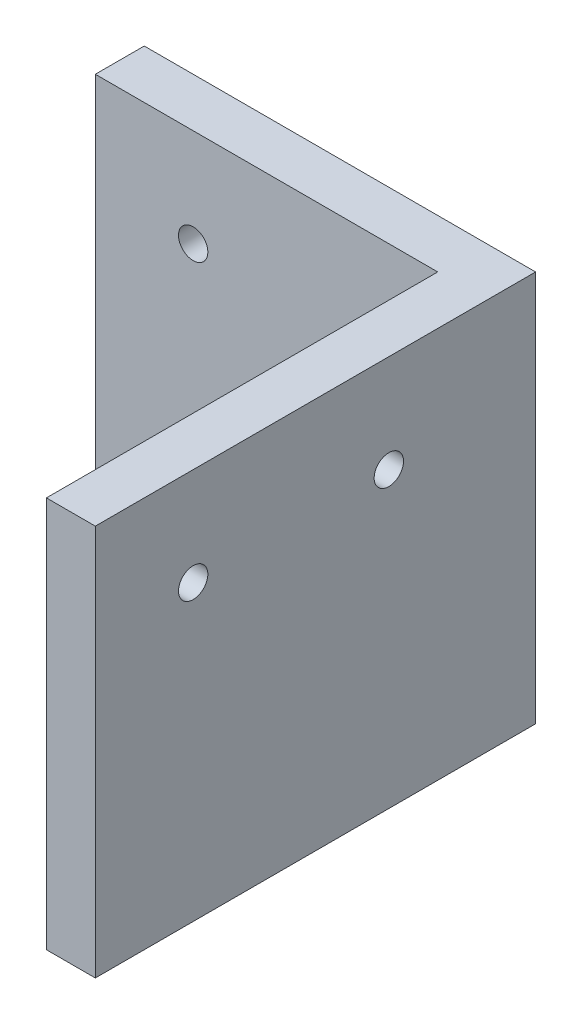
from build123d import *

# Parameters (mm, degrees)
BOSS_EXTRUDE1_DEPTH  = 597.1
SKETCH2_W            = 65.2
SKETCH2_H            = 400
CUT_EXTRUDE1_DEPTH   = 800.095369778
BOSS_EXTRUDE2_DEPTH  = 8
SKETCH4_W            = 525
SKETCH4_H            = 597.1
BOSS_EXTRUDE3_DEPTH  = 7
SKETCH5_W            = 365
SKETCH5_H            = 597.1
CUT_EXTRUDE2_DEPTH   = 10
CUT_EXTRUDE3_REACH   = 802.736
SKETCH6_R            = 2.125
SKETCH7_W            = 20
SKETCH7_H            = 597.1
CUT_EXTRUDE4_DEPTH   = 5
SKETCH8_W            = 55.055493435
SKETCH8_H            = 20
CUT_EXTRUDE6_DEPTH   = 60
BOSS_EXTRUDE4_REACH  = 799.121
SKETCH13_W           = 40
SKETCH13_H           = 15
SKETCH14_W           = 20
SKETCH14_H           = 597.1
CUT_EXTRUDE7_DEPTH   = 5
CUT_EXTRUDE8_REACH   = 802.736
SKETCH15_R           = 1.33
SKETCH16_W           = 35
SKETCH16_H           = 15
CUT_EXTRUDE9_DEPTH   = 60
SKETCH17_W           = 60
SKETCH17_H           = 150
CUT_EXTRUDE10_DEPTH  = 40
SKETCH18_W           = 12
SKETCH18_H           = 16
CUT_EXTRUDE11_DEPTH  = 800.298073312
SKETCH19_W           = 8
SKETCH19_H           = 7
CUT_EXTRUDE12_DEPTH  = 10
CUT_EXTRUDE13_REACH  = 802.736
SKETCH20_R           = 2.75986214
SKETCH20_R_2         = 2.757960919
SKETCH20_R_3         = 2.776094021
SKETCH20_R_4         = 2.751394876
CUT_EXTRUDE14_REACH  = 802.736
SKETCH21_R           = 1.643359813
SKETCH21_R_2         = 1.638913006
SKETCH21_R_3         = 1.644479807
SKETCH21_R_4         = 1.70596398
SKETCH21_R_5         = 1.645380558
SKETCH21_R_6         = 1.646601879
SKETCH21_R_7         = 1.661334202
SKETCH21_R_8         = 1.701244733
CUT_EXTRUDE15_REACH  = 752.719
SKETCH22_W           = 15
SKETCH22_H           = 20
CUT_EXTRUDE16_REACH  = 802.736
SKETCH24_R           = 1.5
SKETCH27_W           = 35
SKETCH27_H           = 15
CUT_EXTRUDE17_DEPTH  = 60
CUT_EXTRUDE18_START  = -60
SKETCH28_W           = 35
SKETCH28_H           = 15
SKETCH28_R           = 1.5
CUT_EXTRUDE18_DEPTH  = 60
SKETCH29_W           = 60
SKETCH29_H           = 150
CUT_EXTRUDE19_DEPTH  = 40
CUT_EXTRUDE20_REACH  = 802.736
SKETCH33_R           = 2.5
SKETCH37_W           = 55
SKETCH37_H           = 20
CUT_EXTRUDE21_DEPTH  = 60
SKETCH39_W           = 5
SKETCH39_H           = 40
BOSS_EXTRUDE6_DEPTH  = 40
SKETCH41_R           = 1.5
CUT_EXTRUDE22_DEPTH  = 799.501603004
SKETCH42_W           = 35
SKETCH42_H           = 15
BOSS_EXTRUDE7_DEPTH  = 60
SKETCH43_W           = 41.147889502
SKETCH43_H           = 41.618954825
SKETCH43_W_2         = 42.4363484
SKETCH43_H_2         = 40
BOSS_EXTRUDE8_DEPTH  = 20
SKETCH44_W           = 49.636924656
SKETCH44_H           = 46.225017069
SKETCH44_W_2         = 46.873520021
BOSS_EXTRUDE9_DEPTH  = 20
SKETCH45_W           = 35
SKETCH45_H           = 15
BOSS_EXTRUDE10_DEPTH = 60
SKETCH46_W           = 5
SKETCH46_H           = 40
BOSS_EXTRUDE11_DEPTH = 40
SKETCH47_R           = 1.5
CUT_EXTRUDE23_DEPTH  = 826.351325194
FILLET1_R            = 5
FILLET2_R            = 5
SKETCH51_W           = 40
SKETCH51_H           = 40
BOSS_EXTRUDE12_DEPTH = 5
SKETCH52_R           = 3
CUT_EXTRUDE26_DEPTH  = 831.93526222
SKETCH53_R           = 3.280439698
BOSS_EXTRUDE13_DEPTH = 570
CUT_EXTRUDE27_START  = -40
SKETCH54_R           = 3.280439698
CUT_EXTRUDE27_DEPTH  = 40
SKETCH55_W           = 485
SKETCH55_H           = 14.478767201
CUT_EXTRUDE28_DEPTH  = 40
SKETCH57_W           = 723.186896727
SKETCH57_H           = 160.707941424
CUT_EXTRUDE30_DEPTH  = 828.51338962
SKETCH58_R           = 4.695658324
SKETCH58_R_2         = 1.5
SKETCH58_R_3         = 4.862906044
BOSS_EXTRUDE14_DEPTH = 5
SKETCH59_R           = 3.5
CUT_EXTRUDE31_DEPTH  = 1.5


with BuildPart() as part:
    # Sketch1 → Boss-Extrude1 (new body)
    with BuildSketch(Plane.XY):
        Polygon((0, 95), (0, 0), (237.916666667, 0), (262.5, 0), (262.5, 15), (80, 15), (80, 80), (70, 80), (70, 75), (50, 75), (50, 80), (40, 80), (40, 75), (20, 75), (20, 95), align=None)
        Polygon((262.5, 15), (262.5, 0), (287.083333333, 0), (525, 0), (525, 95), (505, 95), (505, 75), (485, 75), (485, 80), (475, 80), (475, 75), (455, 75), (455, 80), (445, 80), (445, 15), align=None)
    extrude(amount=BOSS_EXTRUDE1_DEPTH)

    # Sketch2 → Cut-Extrude1 (cut, through all)
    with BuildSketch(Plane(origin=(0, 15, 0), x_dir=(1, 0, 0), z_dir=(0, 1, 0))):
        with Locations((219.9, -200)):
            Rectangle(SKETCH2_W, SKETCH2_H)
        with Locations((305.1, -397.1)):
            Rectangle(SKETCH2_W, SKETCH2_H)
    extrude(amount=-CUT_EXTRUDE1_DEPTH, mode=Mode.SUBTRACT)

    # Sketch3 → Boss-Extrude2 (add)
    with BuildSketch(Plane(origin=(0, 15, 0), x_dir=(1, 0, 0), z_dir=(0, 1, 0))):
        Polygon((252.5, -400), (187.3, -400), (187.3, 0), (80, 0), (80, -597.1), (272.5, -597.1), (272.5, -197.1), (337.7, -197.1), (337.7, -597.1), (445, -597.1), (445, 0), (252.5, 0), align=None)
    extrude(amount=BOSS_EXTRUDE2_DEPTH)

    # Sketch4 → Boss-Extrude3 (add)
    with BuildSketch(Plane.XZ):
        with Locations((262.5, 298.55)):
            Rectangle(SKETCH4_W, SKETCH4_H)
    extrude(amount=BOSS_EXTRUDE3_DEPTH)

    # Sketch5 → Cut-Extrude2 (cut)
    with BuildSketch(Plane(origin=(0, 23, 0), x_dir=(1, 0, 0), z_dir=(0, 1, 0))):
        with Locations((262.5, -298.55)):
            Rectangle(SKETCH5_W, SKETCH5_H)
    extrude(amount=-CUT_EXTRUDE2_DEPTH, mode=Mode.SUBTRACT)

    # Sketch6 → Cut-Extrude3 (cut, up to next)
    with BuildSketch(Plane(origin=(525, 0, 0), x_dir=(0, 0, -1), z_dir=(1, 0, 0)), mode=Mode.PRIVATE) as cut_extrude3_sk1:
        with Locations((-318.55, 79)):
            Circle(SKETCH6_R)
    cut_extrude3_tool1 = extrude(cut_extrude3_sk1.sketch, amount=-CUT_EXTRUDE3_REACH, mode=Mode.PRIVATE) & part.part
    # Sketch6 → Cut-Extrude3 (cut, up to next)
    with BuildSketch(Plane(origin=(525, 0, 0), x_dir=(0, 0, -1), z_dir=(1, 0, 0)), mode=Mode.PRIVATE) as cut_extrude3_sk2:
        with Locations((-318.55, 63)):
            Circle(SKETCH6_R)
    cut_extrude3_tool2 = extrude(cut_extrude3_sk2.sketch, amount=-CUT_EXTRUDE3_REACH, mode=Mode.PRIVATE) & part.part
    # Sketch6 → Cut-Extrude3 (cut, up to next)
    with BuildSketch(Plane(origin=(525, 0, 0), x_dir=(0, 0, -1), z_dir=(1, 0, 0)), mode=Mode.PRIVATE) as cut_extrude3_sk3:
        with Locations((-278.55, 63)):
            Circle(SKETCH6_R)
    cut_extrude3_tool3 = extrude(cut_extrude3_sk3.sketch, amount=-CUT_EXTRUDE3_REACH, mode=Mode.PRIVATE) & part.part
    # Sketch6 → Cut-Extrude3 (cut, up to next)
    with BuildSketch(Plane(origin=(525, 0, 0), x_dir=(0, 0, -1), z_dir=(1, 0, 0)), mode=Mode.PRIVATE) as cut_extrude3_sk4:
        with Locations((-278.55, 79)):
            Circle(SKETCH6_R)
    cut_extrude3_tool4 = extrude(cut_extrude3_sk4.sketch, amount=-CUT_EXTRUDE3_REACH, mode=Mode.PRIVATE) & part.part
    add(cut_extrude3_tool1.solids().sort_by_distance((525, 79, 318.55))[0], mode=Mode.SUBTRACT)
    add(cut_extrude3_tool2.solids().sort_by_distance((525, 63, 318.55))[0], mode=Mode.SUBTRACT)
    add(cut_extrude3_tool3.solids().sort_by_distance((525, 63, 278.55))[0], mode=Mode.SUBTRACT)
    add(cut_extrude3_tool4.solids().sort_by_distance((525, 79, 278.55))[0], mode=Mode.SUBTRACT)

    # Sketch7 → Cut-Extrude4 (cut)
    with BuildSketch(Plane(origin=(0, 75, 0), x_dir=(1, 0, 0), z_dir=(0, 1, 0))):
        with Locations((495, -298.55)):
            Rectangle(SKETCH7_W, SKETCH7_H)
    extrude(amount=-CUT_EXTRUDE4_DEPTH, mode=Mode.SUBTRACT)

    # Sketch8 → Cut-Extrude6 (cut)
    with BuildSketch(Plane.ZY.offset(-445)):
        with Locations((297.395302375, 60)):
            Rectangle(SKETCH8_W, SKETCH8_H)
    extrude(amount=-CUT_EXTRUDE6_DEPTH, mode=Mode.SUBTRACT)

    # Sketch13 → Boss-Extrude4 (add, up to next)
    with BuildSketch(Plane(origin=(0, 50, 0), x_dir=(1, 0, 0), z_dir=(0, 1, 0)), mode=Mode.PRIVATE) as boss_extrude4_sk1:
        with Locations((465, -297.800707188)):
            Rectangle(SKETCH13_W, SKETCH13_H)
    boss_extrude4_tool1 = extrude(boss_extrude4_sk1.sketch, amount=BOSS_EXTRUDE4_REACH, mode=Mode.PRIVATE) - part.part
    add(boss_extrude4_tool1.solids().sort_by_distance((465, 50, 297.800707))[0])

    # Sketch14 → Cut-Extrude7 (cut)
    with BuildSketch(Plane(origin=(0, 75, 0), x_dir=(1, 0, 0), z_dir=(0, 1, 0))):
        with Locations((30, -298.55)):
            Rectangle(SKETCH14_W, SKETCH14_H)
    extrude(amount=-CUT_EXTRUDE7_DEPTH, mode=Mode.SUBTRACT)

    # Sketch15 → Cut-Extrude8 (cut, up to next)
    with BuildSketch(Plane.ZY, mode=Mode.PRIVATE) as cut_extrude8_sk1:
        with Locations((13.5, 82.3)):
            Circle(SKETCH15_R)
    cut_extrude8_tool1 = extrude(cut_extrude8_sk1.sketch, amount=-CUT_EXTRUDE8_REACH, mode=Mode.PRIVATE) & part.part
    # Sketch15 → Cut-Extrude8 (cut, up to next)
    with BuildSketch(Plane.ZY, mode=Mode.PRIVATE) as cut_extrude8_sk2:
        with Locations((33.5, 82.3)):
            Circle(SKETCH15_R)
    cut_extrude8_tool2 = extrude(cut_extrude8_sk2.sketch, amount=-CUT_EXTRUDE8_REACH, mode=Mode.PRIVATE) & part.part
    # Sketch15 → Cut-Extrude8 (cut, up to next)
    with BuildSketch(Plane.ZY, mode=Mode.PRIVATE) as cut_extrude8_sk3:
        with Locations((13.5, 62.3)):
            Circle(SKETCH15_R)
    cut_extrude8_tool3 = extrude(cut_extrude8_sk3.sketch, amount=-CUT_EXTRUDE8_REACH, mode=Mode.PRIVATE) & part.part
    # Sketch15 → Cut-Extrude8 (cut, up to next)
    with BuildSketch(Plane.ZY, mode=Mode.PRIVATE) as cut_extrude8_sk4:
        with Locations((33.5, 62.3)):
            Circle(SKETCH15_R)
    cut_extrude8_tool4 = extrude(cut_extrude8_sk4.sketch, amount=-CUT_EXTRUDE8_REACH, mode=Mode.PRIVATE) & part.part
    # Sketch15 → Cut-Extrude8 (cut, up to next)
    with BuildSketch(Plane.ZY, mode=Mode.PRIVATE) as cut_extrude8_sk5:
        with Locations((563.6, 82.3)):
            Circle(SKETCH15_R)
    cut_extrude8_tool5 = extrude(cut_extrude8_sk5.sketch, amount=-CUT_EXTRUDE8_REACH, mode=Mode.PRIVATE) & part.part
    # Sketch15 → Cut-Extrude8 (cut, up to next)
    with BuildSketch(Plane.ZY, mode=Mode.PRIVATE) as cut_extrude8_sk6:
        with Locations((583.6, 62.3)):
            Circle(SKETCH15_R)
    cut_extrude8_tool6 = extrude(cut_extrude8_sk6.sketch, amount=-CUT_EXTRUDE8_REACH, mode=Mode.PRIVATE) & part.part
    # Sketch15 → Cut-Extrude8 (cut, up to next)
    with BuildSketch(Plane.ZY, mode=Mode.PRIVATE) as cut_extrude8_sk7:
        with Locations((563.6, 62.3)):
            Circle(SKETCH15_R)
    cut_extrude8_tool7 = extrude(cut_extrude8_sk7.sketch, amount=-CUT_EXTRUDE8_REACH, mode=Mode.PRIVATE) & part.part
    # Sketch15 → Cut-Extrude8 (cut, up to next)
    with BuildSketch(Plane.ZY, mode=Mode.PRIVATE) as cut_extrude8_sk8:
        with Locations(Location((583.6, 82.3, 0), (0, 0, 90))):
            Circle(SKETCH15_R)
    cut_extrude8_tool8 = extrude(cut_extrude8_sk8.sketch, amount=-CUT_EXTRUDE8_REACH, mode=Mode.PRIVATE) & part.part
    add(cut_extrude8_tool1.solids().sort_by_distance((0, 82.3, 13.5))[0], mode=Mode.SUBTRACT)
    add(cut_extrude8_tool2.solids().sort_by_distance((0, 82.3, 33.5))[0], mode=Mode.SUBTRACT)
    add(cut_extrude8_tool3.solids().sort_by_distance((0, 62.3, 13.5))[0], mode=Mode.SUBTRACT)
    add(cut_extrude8_tool4.solids().sort_by_distance((0, 62.3, 33.5))[0], mode=Mode.SUBTRACT)
    add(cut_extrude8_tool5.solids().sort_by_distance((0, 82.3, 563.6))[0], mode=Mode.SUBTRACT)
    add(cut_extrude8_tool6.solids().sort_by_distance((0, 62.3, 583.6))[0], mode=Mode.SUBTRACT)
    add(cut_extrude8_tool7.solids().sort_by_distance((0, 62.3, 563.6))[0], mode=Mode.SUBTRACT)
    add(cut_extrude8_tool8.solids().sort_by_distance((0, 82.3, 583.6))[0], mode=Mode.SUBTRACT)

    # Sketch16 → Cut-Extrude9 (cut)
    with BuildSketch(Plane(origin=(80, 0, 0), x_dir=(0, 0, -1), z_dir=(1, 0, 0))):
        with Locations((-574.6, 62.5)):
            Rectangle(SKETCH16_W, SKETCH16_H)
        with Locations((-22.5, 62.5)):
            Rectangle(SKETCH16_W, SKETCH16_H)
    extrude(amount=-CUT_EXTRUDE9_DEPTH, mode=Mode.SUBTRACT)

    # Sketch17 → Cut-Extrude10 (cut)
    with BuildSketch(Plane.XZ.offset(7)):
        with Locations((495, 298.55)):
            Rectangle(SKETCH17_W, SKETCH17_H)
    extrude(amount=-CUT_EXTRUDE10_DEPTH, mode=Mode.SUBTRACT)

    # Sketch18 → Cut-Extrude11 (cut, through all)
    with BuildSketch(Plane(origin=(0, 13, 0), x_dir=(1, 0, 0), z_dir=(0, 1, 0))):
        with Locations((421, -294.05)):
            Rectangle(SKETCH18_W, SKETCH18_H)
    extrude(amount=-CUT_EXTRUDE11_DEPTH, mode=Mode.SUBTRACT)

    # Sketch19 → Cut-Extrude12 (cut)
    with BuildSketch(Plane(origin=(0, 13, 0), x_dir=(1, 0, 0), z_dir=(0, 1, 0))):
        with Locations((421, -282.55)):
            Rectangle(SKETCH19_W, SKETCH19_H)
        with Locations((421, -305.55)):
            Rectangle(SKETCH19_W, SKETCH19_H)
    extrude(amount=-CUT_EXTRUDE12_DEPTH, mode=Mode.SUBTRACT)

    # Sketch20 → Cut-Extrude13 (cut, up to next)
    with BuildSketch(Plane(origin=(525, 0, 0), x_dir=(0, 0, -1), z_dir=(1, 0, 0)), mode=Mode.PRIVATE) as cut_extrude13_sk1:
        with Locations((-318.55, 79)):
            Circle(SKETCH20_R)
    cut_extrude13_tool1 = extrude(cut_extrude13_sk1.sketch, amount=-CUT_EXTRUDE13_REACH, mode=Mode.PRIVATE) & part.part
    # Sketch20 → Cut-Extrude13 (cut, up to next)
    with BuildSketch(Plane(origin=(525, 0, 0), x_dir=(0, 0, -1), z_dir=(1, 0, 0)), mode=Mode.PRIVATE) as cut_extrude13_sk2:
        with Locations((-318.55, 63)):
            Circle(SKETCH20_R_2)
    cut_extrude13_tool2 = extrude(cut_extrude13_sk2.sketch, amount=-CUT_EXTRUDE13_REACH, mode=Mode.PRIVATE) & part.part
    # Sketch20 → Cut-Extrude13 (cut, up to next)
    with BuildSketch(Plane(origin=(525, 0, 0), x_dir=(0, 0, -1), z_dir=(1, 0, 0)), mode=Mode.PRIVATE) as cut_extrude13_sk3:
        with Locations((-278.55, 63)):
            Circle(SKETCH20_R_3)
    cut_extrude13_tool3 = extrude(cut_extrude13_sk3.sketch, amount=-CUT_EXTRUDE13_REACH, mode=Mode.PRIVATE) & part.part
    # Sketch20 → Cut-Extrude13 (cut, up to next)
    with BuildSketch(Plane(origin=(525, 0, 0), x_dir=(0, 0, -1), z_dir=(1, 0, 0)), mode=Mode.PRIVATE) as cut_extrude13_sk4:
        with Locations((-278.55, 79)):
            Circle(SKETCH20_R_4)
    cut_extrude13_tool4 = extrude(cut_extrude13_sk4.sketch, amount=-CUT_EXTRUDE13_REACH, mode=Mode.PRIVATE) & part.part
    add(cut_extrude13_tool1.solids().sort_by_distance((525, 79, 318.55))[0], mode=Mode.SUBTRACT)
    add(cut_extrude13_tool2.solids().sort_by_distance((525, 63, 318.55))[0], mode=Mode.SUBTRACT)
    add(cut_extrude13_tool3.solids().sort_by_distance((525, 63, 278.55))[0], mode=Mode.SUBTRACT)
    add(cut_extrude13_tool4.solids().sort_by_distance((525, 79, 278.55))[0], mode=Mode.SUBTRACT)

    # Sketch21 → Cut-Extrude14 (cut, up to next)
    with BuildSketch(Plane.ZY, mode=Mode.PRIVATE) as cut_extrude14_sk1:
        with Locations((13.5, 82.3)):
            Circle(SKETCH21_R)
    cut_extrude14_tool1 = extrude(cut_extrude14_sk1.sketch, amount=-CUT_EXTRUDE14_REACH, mode=Mode.PRIVATE) & part.part
    # Sketch21 → Cut-Extrude14 (cut, up to next)
    with BuildSketch(Plane.ZY, mode=Mode.PRIVATE) as cut_extrude14_sk2:
        with Locations((13.5, 62.3)):
            Circle(SKETCH21_R_2)
    cut_extrude14_tool2 = extrude(cut_extrude14_sk2.sketch, amount=-CUT_EXTRUDE14_REACH, mode=Mode.PRIVATE) & part.part
    # Sketch21 → Cut-Extrude14 (cut, up to next)
    with BuildSketch(Plane.ZY, mode=Mode.PRIVATE) as cut_extrude14_sk3:
        with Locations((33.5, 62.3)):
            Circle(SKETCH21_R_3)
    cut_extrude14_tool3 = extrude(cut_extrude14_sk3.sketch, amount=-CUT_EXTRUDE14_REACH, mode=Mode.PRIVATE) & part.part
    # Sketch21 → Cut-Extrude14 (cut, up to next)
    with BuildSketch(Plane.ZY, mode=Mode.PRIVATE) as cut_extrude14_sk4:
        with Locations((33.5, 82.3)):
            Circle(SKETCH21_R_4)
    cut_extrude14_tool4 = extrude(cut_extrude14_sk4.sketch, amount=-CUT_EXTRUDE14_REACH, mode=Mode.PRIVATE) & part.part
    # Sketch21 → Cut-Extrude14 (cut, up to next)
    with BuildSketch(Plane.ZY, mode=Mode.PRIVATE) as cut_extrude14_sk5:
        with Locations((563.6, 62.3)):
            Circle(SKETCH21_R_5)
    cut_extrude14_tool5 = extrude(cut_extrude14_sk5.sketch, amount=-CUT_EXTRUDE14_REACH, mode=Mode.PRIVATE) & part.part
    # Sketch21 → Cut-Extrude14 (cut, up to next)
    with BuildSketch(Plane.ZY, mode=Mode.PRIVATE) as cut_extrude14_sk6:
        with Locations((583.6, 62.3)):
            Circle(SKETCH21_R_6)
    cut_extrude14_tool6 = extrude(cut_extrude14_sk6.sketch, amount=-CUT_EXTRUDE14_REACH, mode=Mode.PRIVATE) & part.part
    # Sketch21 → Cut-Extrude14 (cut, up to next)
    with BuildSketch(Plane.ZY, mode=Mode.PRIVATE) as cut_extrude14_sk7:
        with Locations((583.6, 82.3)):
            Circle(SKETCH21_R_7)
    cut_extrude14_tool7 = extrude(cut_extrude14_sk7.sketch, amount=-CUT_EXTRUDE14_REACH, mode=Mode.PRIVATE) & part.part
    # Sketch21 → Cut-Extrude14 (cut, up to next)
    with BuildSketch(Plane.ZY, mode=Mode.PRIVATE) as cut_extrude14_sk8:
        with Locations((563.6, 82.3)):
            Circle(SKETCH21_R_8)
    cut_extrude14_tool8 = extrude(cut_extrude14_sk8.sketch, amount=-CUT_EXTRUDE14_REACH, mode=Mode.PRIVATE) & part.part
    add(cut_extrude14_tool1.solids().sort_by_distance((0, 82.3, 13.5))[0], mode=Mode.SUBTRACT)
    add(cut_extrude14_tool2.solids().sort_by_distance((0, 62.3, 13.5))[0], mode=Mode.SUBTRACT)
    add(cut_extrude14_tool3.solids().sort_by_distance((0, 62.3, 33.5))[0], mode=Mode.SUBTRACT)
    add(cut_extrude14_tool4.solids().sort_by_distance((0, 82.3, 33.5))[0], mode=Mode.SUBTRACT)
    add(cut_extrude14_tool5.solids().sort_by_distance((0, 62.3, 563.6))[0], mode=Mode.SUBTRACT)
    add(cut_extrude14_tool6.solids().sort_by_distance((0, 62.3, 583.6))[0], mode=Mode.SUBTRACT)
    add(cut_extrude14_tool7.solids().sort_by_distance((0, 82.3, 583.6))[0], mode=Mode.SUBTRACT)
    add(cut_extrude14_tool8.solids().sort_by_distance((0, 82.3, 563.6))[0], mode=Mode.SUBTRACT)

    # Sketch22 → Cut-Extrude15 (cut, up to next)
    with BuildSketch(Plane.ZY.offset(-445), mode=Mode.PRIVATE) as cut_extrude15_sk1:
        with Locations((297.800707188, 60)):
            Rectangle(SKETCH22_W, SKETCH22_H)
    cut_extrude15_tool1 = extrude(cut_extrude15_sk1.sketch, amount=-CUT_EXTRUDE15_REACH, mode=Mode.PRIVATE) & part.part
    add(cut_extrude15_tool1.solids().sort_by_distance((445, 60, 297.800707))[0], mode=Mode.SUBTRACT)

    # Sketch24 → Cut-Extrude16 (cut, up to next)
    with BuildSketch(Plane(origin=(525, 0, 0), x_dir=(0, 0, -1), z_dir=(1, 0, 0)), mode=Mode.PRIVATE) as cut_extrude16_sk1:
        with Locations((-583.6, 82.3)):
            Circle(SKETCH24_R)
    cut_extrude16_tool1 = extrude(cut_extrude16_sk1.sketch, amount=-CUT_EXTRUDE16_REACH, mode=Mode.PRIVATE) & part.part
    # Sketch24 → Cut-Extrude16 (cut, up to next)
    with BuildSketch(Plane(origin=(525, 0, 0), x_dir=(0, 0, -1), z_dir=(1, 0, 0)), mode=Mode.PRIVATE) as cut_extrude16_sk2:
        with Locations((-563.6, 82.3)):
            Circle(SKETCH24_R)
    cut_extrude16_tool2 = extrude(cut_extrude16_sk2.sketch, amount=-CUT_EXTRUDE16_REACH, mode=Mode.PRIVATE) & part.part
    # Sketch24 → Cut-Extrude16 (cut, up to next)
    with BuildSketch(Plane(origin=(525, 0, 0), x_dir=(0, 0, -1), z_dir=(1, 0, 0)), mode=Mode.PRIVATE) as cut_extrude16_sk3:
        with Locations((-583.6, 62.3)):
            Circle(SKETCH24_R)
    cut_extrude16_tool3 = extrude(cut_extrude16_sk3.sketch, amount=-CUT_EXTRUDE16_REACH, mode=Mode.PRIVATE) & part.part
    # Sketch24 → Cut-Extrude16 (cut, up to next)
    with BuildSketch(Plane(origin=(525, 0, 0), x_dir=(0, 0, -1), z_dir=(1, 0, 0)), mode=Mode.PRIVATE) as cut_extrude16_sk4:
        with Locations((-563.6, 62.3)):
            Circle(SKETCH24_R)
    cut_extrude16_tool4 = extrude(cut_extrude16_sk4.sketch, amount=-CUT_EXTRUDE16_REACH, mode=Mode.PRIVATE) & part.part
    # Sketch24 → Cut-Extrude16 (cut, up to next)
    with BuildSketch(Plane(origin=(525, 0, 0), x_dir=(0, 0, -1), z_dir=(1, 0, 0)), mode=Mode.PRIVATE) as cut_extrude16_sk5:
        with Locations((-33.5, 82.3)):
            Circle(SKETCH24_R)
    cut_extrude16_tool5 = extrude(cut_extrude16_sk5.sketch, amount=-CUT_EXTRUDE16_REACH, mode=Mode.PRIVATE) & part.part
    # Sketch24 → Cut-Extrude16 (cut, up to next)
    with BuildSketch(Plane(origin=(525, 0, 0), x_dir=(0, 0, -1), z_dir=(1, 0, 0)), mode=Mode.PRIVATE) as cut_extrude16_sk6:
        with Locations((-13.5, 82.3)):
            Circle(SKETCH24_R)
    cut_extrude16_tool6 = extrude(cut_extrude16_sk6.sketch, amount=-CUT_EXTRUDE16_REACH, mode=Mode.PRIVATE) & part.part
    # Sketch24 → Cut-Extrude16 (cut, up to next)
    with BuildSketch(Plane(origin=(525, 0, 0), x_dir=(0, 0, -1), z_dir=(1, 0, 0)), mode=Mode.PRIVATE) as cut_extrude16_sk7:
        with Locations((-13.5, 62.3)):
            Circle(SKETCH24_R)
    cut_extrude16_tool7 = extrude(cut_extrude16_sk7.sketch, amount=-CUT_EXTRUDE16_REACH, mode=Mode.PRIVATE) & part.part
    # Sketch24 → Cut-Extrude16 (cut, up to next)
    with BuildSketch(Plane(origin=(525, 0, 0), x_dir=(0, 0, -1), z_dir=(1, 0, 0)), mode=Mode.PRIVATE) as cut_extrude16_sk8:
        with Locations((-33.5, 62.3)):
            Circle(SKETCH24_R)
    cut_extrude16_tool8 = extrude(cut_extrude16_sk8.sketch, amount=-CUT_EXTRUDE16_REACH, mode=Mode.PRIVATE) & part.part
    add(cut_extrude16_tool1.solids().sort_by_distance((525, 82.3, 583.6))[0], mode=Mode.SUBTRACT)
    add(cut_extrude16_tool2.solids().sort_by_distance((525, 82.3, 563.6))[0], mode=Mode.SUBTRACT)
    add(cut_extrude16_tool3.solids().sort_by_distance((525, 62.3, 583.6))[0], mode=Mode.SUBTRACT)
    add(cut_extrude16_tool4.solids().sort_by_distance((525, 62.3, 563.6))[0], mode=Mode.SUBTRACT)
    add(cut_extrude16_tool5.solids().sort_by_distance((525, 82.3, 33.5))[0], mode=Mode.SUBTRACT)
    add(cut_extrude16_tool6.solids().sort_by_distance((525, 82.3, 13.5))[0], mode=Mode.SUBTRACT)
    add(cut_extrude16_tool7.solids().sort_by_distance((525, 62.3, 13.5))[0], mode=Mode.SUBTRACT)
    add(cut_extrude16_tool8.solids().sort_by_distance((525, 62.3, 33.5))[0], mode=Mode.SUBTRACT)

    # Sketch27 → Cut-Extrude17 (cut)
    with BuildSketch(Plane.ZY.offset(-445)):
        with Locations((574.6, 62.5)):
            Rectangle(SKETCH27_W, SKETCH27_H)
    extrude(amount=-CUT_EXTRUDE17_DEPTH, mode=Mode.SUBTRACT)

    # Sketch28 → Cut-Extrude18 (cut)
    with BuildSketch(Plane.ZY.offset(-445).offset(CUT_EXTRUDE18_START)):
        with Locations((22.5, 62.5)):
            Rectangle(SKETCH28_W, SKETCH28_H)
        with Locations(Location((13.5, 62.3, 0), (0, 0, 180))):
            Circle(SKETCH28_R, mode=Mode.SUBTRACT)
        with Locations(Location((33.5, 62.3, 0), (0, 0, 180))):
            Circle(SKETCH28_R, mode=Mode.SUBTRACT)
    extrude(amount=CUT_EXTRUDE18_DEPTH, mode=Mode.SUBTRACT)

    # Sketch29 → Cut-Extrude19 (cut)
    with BuildSketch(Plane.XZ.offset(7)):
        with Locations((30, 298.55)):
            Rectangle(SKETCH29_W, SKETCH29_H)
    extrude(amount=-CUT_EXTRUDE19_DEPTH, mode=Mode.SUBTRACT)

    # Sketch33 → Cut-Extrude20 (cut, up to next)
    with BuildSketch(Plane.ZY, mode=Mode.PRIVATE) as cut_extrude20_sk1:
        with Locations((318.55, 79)):
            Circle(SKETCH33_R)
    cut_extrude20_tool1 = extrude(cut_extrude20_sk1.sketch, amount=-CUT_EXTRUDE20_REACH, mode=Mode.PRIVATE) & part.part
    # Sketch33 → Cut-Extrude20 (cut, up to next)
    with BuildSketch(Plane.ZY, mode=Mode.PRIVATE) as cut_extrude20_sk2:
        with Locations((319.356498111, 63)):
            Circle(SKETCH33_R)
    cut_extrude20_tool2 = extrude(cut_extrude20_sk2.sketch, amount=-CUT_EXTRUDE20_REACH, mode=Mode.PRIVATE) & part.part
    # Sketch33 → Cut-Extrude20 (cut, up to next)
    with BuildSketch(Plane.ZY, mode=Mode.PRIVATE) as cut_extrude20_sk3:
        with Locations((278.55, 79)):
            Circle(SKETCH33_R)
    cut_extrude20_tool3 = extrude(cut_extrude20_sk3.sketch, amount=-CUT_EXTRUDE20_REACH, mode=Mode.PRIVATE) & part.part
    # Sketch33 → Cut-Extrude20 (cut, up to next)
    with BuildSketch(Plane.ZY, mode=Mode.PRIVATE) as cut_extrude20_sk4:
        with Locations((279.356498111, 63)):
            Circle(SKETCH33_R)
    cut_extrude20_tool4 = extrude(cut_extrude20_sk4.sketch, amount=-CUT_EXTRUDE20_REACH, mode=Mode.PRIVATE) & part.part
    add(cut_extrude20_tool1.solids().sort_by_distance((0, 79, 318.55))[0], mode=Mode.SUBTRACT)
    add(cut_extrude20_tool2.solids().sort_by_distance((0, 63, 319.356498))[0], mode=Mode.SUBTRACT)
    add(cut_extrude20_tool3.solids().sort_by_distance((0, 79, 278.55))[0], mode=Mode.SUBTRACT)
    add(cut_extrude20_tool4.solids().sort_by_distance((0, 63, 279.356498))[0], mode=Mode.SUBTRACT)

    # Sketch37 → Cut-Extrude21 (cut)
    with BuildSketch(Plane(origin=(80, 0, 0), x_dir=(0, 0, -1), z_dir=(1, 0, 0))):
        with Locations((-299.68, 60)):
            Rectangle(SKETCH37_W, SKETCH37_H)
    extrude(amount=-CUT_EXTRUDE21_DEPTH, mode=Mode.SUBTRACT)

    # Sketch39 → Boss-Extrude6 (add)
    with BuildSketch(Plane.ZY):
        with Locations((5.5, 75)):
            Rectangle(SKETCH39_W, SKETCH39_H)
        with Locations((591.6, 75)):
            Rectangle(SKETCH39_W, SKETCH39_H)
    extrude(amount=BOSS_EXTRUDE6_DEPTH)

    # Sketch41 → Cut-Extrude22 (cut, through all)
    with BuildSketch(Plane(origin=(0, 0, 3), x_dir=(-1, 0, 0), z_dir=(0, 0, -1))):
        with Locations((10, 85)):
            Circle(SKETCH41_R)
        with Locations((30, 85)):
            Circle(SKETCH41_R)
        with Locations((30, 65)):
            Circle(SKETCH41_R)
        with Locations((10, 65)):
            Circle(SKETCH41_R)
    extrude(amount=-CUT_EXTRUDE22_DEPTH, mode=Mode.SUBTRACT)

    # Sketch42 → Boss-Extrude7 (add)
    with BuildSketch(Plane(origin=(80, 0, 0), x_dir=(0, 0, -1), z_dir=(1, 0, 0))):
        with Locations((-574.6, 62.5)):
            Rectangle(SKETCH42_W, SKETCH42_H)
        with Locations((-22.5, 62.5)):
            Rectangle(SKETCH42_W, SKETCH42_H)
    extrude(amount=-BOSS_EXTRUDE7_DEPTH)

    # Sketch43 → Boss-Extrude8 (add)
    with BuildSketch(Plane.ZY):
        with Locations((28.573944751, 74.190522587)):
            Rectangle(SKETCH43_W, SKETCH43_H)
        with Locations((567.8818258, 75)):
            Rectangle(SKETCH43_W_2, SKETCH43_H_2)
    extrude(amount=-BOSS_EXTRUDE8_DEPTH)

    # Sketch44 → Boss-Extrude9 (add)
    with BuildSketch(Plane(origin=(525, 0, 0), x_dir=(0, 0, -1), z_dir=(1, 0, 0))):
        with Locations((-572.281537672, 71.887491466)):
            Rectangle(SKETCH44_W, SKETCH44_H)
        with Locations((-24.748698221, 71.887491466)):
            Rectangle(SKETCH44_W_2, SKETCH44_H)
    extrude(amount=-BOSS_EXTRUDE9_DEPTH)

    # Sketch45 → Boss-Extrude10 (add)
    with BuildSketch(Plane.ZY.offset(-445)):
        with Locations((22.5, 62.5)):
            Rectangle(SKETCH45_W, SKETCH45_H)
        with Locations((574.6, 62.5)):
            Rectangle(SKETCH45_W, SKETCH45_H)
    extrude(amount=-BOSS_EXTRUDE10_DEPTH)

    # Sketch46 → Boss-Extrude11 (add)
    with BuildSketch(Plane(origin=(525, 0, 0), x_dir=(0, 0, -1), z_dir=(1, 0, 0))):
        with Locations((-591.6, 75)):
            Rectangle(SKETCH46_W, SKETCH46_H)
        with Locations((-5.5, 75)):
            Rectangle(SKETCH46_W, SKETCH46_H)
    extrude(amount=BOSS_EXTRUDE11_DEPTH)

    # Sketch47 → Cut-Extrude23 (cut, through all)
    with BuildSketch(Plane(origin=(0, 0, 3), x_dir=(-1, 0, 0), z_dir=(0, 0, -1))):
        with Locations(Location((-555, 85, 0), (0, 0, 90))):
            Circle(SKETCH47_R)
        with Locations(Location((-535, 84.658315236, 0), (0, 0, 90))):
            Circle(SKETCH47_R)
        with Locations(Location((-535, 64.658315236, 0), (0, 0, 90))):
            Circle(SKETCH47_R)
        with Locations(Location((-555, 65, 0), (0, 0, 90))):
            Circle(SKETCH47_R)
    extrude(amount=-CUT_EXTRUDE23_DEPTH, mode=Mode.SUBTRACT)

    # Fillet1
    fillet1_edges = [part.edges().sort_by_distance(p)[0] for p in [
        (0, 75, 8),
    ]]
    fillet(fillet1_edges, radius=FILLET1_R)

    # Fillet2
    fillet2_edges = [part.edges().sort_by_distance(p)[0] for p in [
        (0, 75, 589.1),
        (525, 75, 589.1),
        (525, 75, 8),
    ]]
    fillet(fillet2_edges, radius=FILLET2_R)

    # Sketch51 → Boss-Extrude12 (add)
    with BuildSketch(Plane.ZY):
        with Locations((28, 75)):
            Rectangle(SKETCH51_W, SKETCH51_H)
    extrude(amount=BOSS_EXTRUDE12_DEPTH)

    # Sketch52 → Cut-Extrude26 (cut, through all)
    with BuildSketch(Plane.ZY.offset(5)):
        with Locations((18, 85)):
            Circle(SKETCH52_R)
        with Locations((28, 85)):
            Circle(SKETCH52_R)
        with Locations((38, 85)):
            Circle(SKETCH52_R)
    extrude(amount=-CUT_EXTRUDE26_DEPTH, mode=Mode.SUBTRACT)

    # Sketch53 → Boss-Extrude13 (add, through all)
    with BuildSketch(Plane.ZY.offset(5)):
        with Locations(Location((28, 85, 0), (0, 0, 90))):
            Circle(SKETCH53_R)
    extrude(amount=-BOSS_EXTRUDE13_DEPTH)

    # Sketch54 → Cut-Extrude27 (cut)
    with BuildSketch(Plane(origin=(565, 0, 0), x_dir=(0, 0, -1), z_dir=(1, 0, 0)).offset(CUT_EXTRUDE27_START)):
        with Locations(Location((-28, 85, 0), (0, 0, 90))):
            Circle(SKETCH54_R)
    extrude(amount=CUT_EXTRUDE27_DEPTH, mode=Mode.SUBTRACT)

    # Sketch55 → Cut-Extrude28 (cut)
    with BuildSketch(Plane(origin=(0, 0, 0), x_dir=(-1, 0, 0), z_dir=(0, 0, -1))):
        with Locations((-262.5, 87.7606164)):
            Rectangle(SKETCH55_W, SKETCH55_H)
    extrude(amount=-CUT_EXTRUDE28_DEPTH, mode=Mode.SUBTRACT)

    # Sketch57 → Cut-Extrude30 (cut, through all)
    with BuildSketch(Plane(origin=(0, 0, 0), x_dir=(-1, 0, 0), z_dir=(0, 0, -1))):
        with Locations((-361.593448364, 14.646029288)):
            Rectangle(SKETCH57_W, SKETCH57_H)
    extrude(amount=-CUT_EXTRUDE30_DEPTH, mode=Mode.SUBTRACT)


with BuildPart() as body_2:
    # of the pieces the cut leaves, the one that is kept (cut_extrude30_keep)
    add(part.part.solids().sort_by_distance((0, 55, 3))[0])

    # Sketch58 → Boss-Extrude14 (add)
    # profile 1 of 2: a face of its own
    with BuildSketch(Plane.ZY.offset(5)):
        with Locations((18, 85)):
            Circle(SKETCH58_R)
        with Locations((18, 85)):
            Circle(SKETCH58_R_2, mode=Mode.SUBTRACT)
    # profile 2 of 2: a face of its own
    with BuildSketch(Plane.ZY.offset(5)):
        with Locations((38, 85)):
            Circle(SKETCH58_R_3)
        with Locations((38, 85)):
            Circle(SKETCH58_R_2, mode=Mode.SUBTRACT)
    extrude(amount=-BOSS_EXTRUDE14_DEPTH)

    # Sketch59 → Cut-Extrude31 (cut)
    with BuildSketch(Plane.ZY.offset(5)):
        with Locations((18, 85)):
            Circle(SKETCH59_R)
        with Locations((38, 85)):
            Circle(SKETCH59_R)
    extrude(amount=-CUT_EXTRUDE31_DEPTH, mode=Mode.SUBTRACT)


solid = body_2.part
